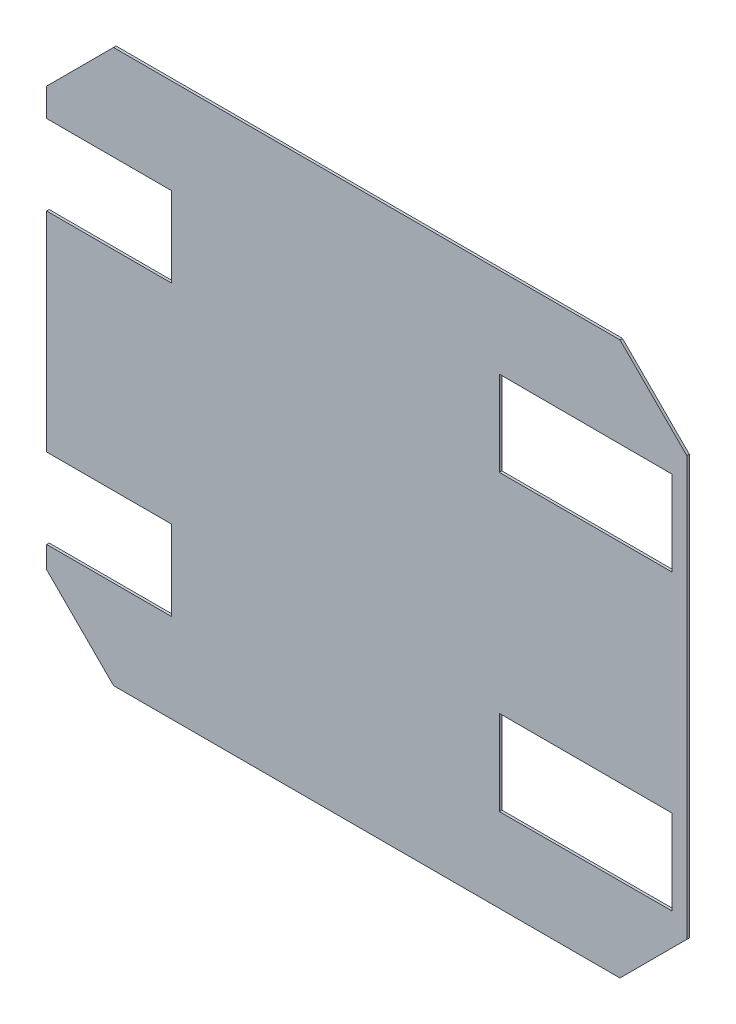
from build123d import *

# Parameters (mm, degrees)
BOSS_EXTRU_1_DEPTH = 2


with BuildPart() as part:
    # Esquisse2 → Boss.-Extru.1 (new body)
    with BuildSketch(Plane.XY):
        Polygon((68.597300567, 260.777491871), (-336.373262181, 260.777491871), (-389.887980807, 207.262773245), (-389.887980807, 184.777491871), (-289.887980807, 184.777491871), (-289.887980807, 120.777491871), (-389.887980807, 120.777491871), (-389.887980807, -46.168159055), (-289.887980807, -46.168159055), (-289.887980807, -110.168159055), (-389.887980807, -110.168159055), (-389.887980807, -127.707789503), (-336.373262181, -181.222508129), (68.597300567, -181.222508129), (122.112019193, -127.707789503), (122.112019193, -46.168159055), (122.112019193, 120.777491871), (122.112019193, 207.262773245), align=None)
        Polygon((110.112019193, 120.777491871), (-27.887980807, 120.777491871), (-27.887980807, 188.777491871), (110.112019193, 188.547731592), align=None, mode=Mode.SUBTRACT)
        Polygon((-27.887980807, -114.168159055), (-27.887980807, -46.168159055), (110.112019193, -46.168159055), (110.112019193, -113.938398776), align=None, mode=Mode.SUBTRACT)
    extrude(amount=BOSS_EXTRU_1_DEPTH)


solid = part.part
